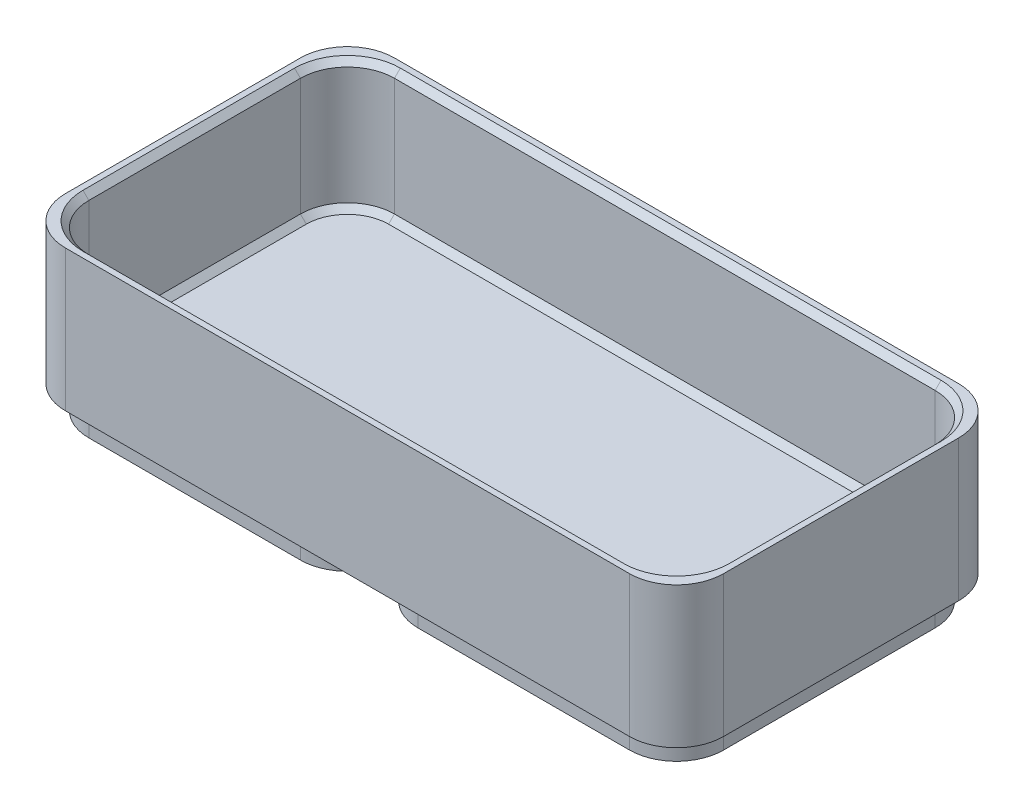
from build123d import *

# Parameters (mm, degrees)
BOSS_EXTRUDE4_DEPTH = 5
SKETCH6_W           = 70
SKETCH6_H           = 70
BOSS_EXTRUDE5_DEPTH = 30
SKETCH8_R           = 3
CUT_EXTRUDE1_DEPTH  = 2
CUT_EXTRUDE2_START  = -30
CUT_EXTRUDE2_DEPTH  = 30
SKETCH10_W          = 140
SKETCH10_H          = 70
BOSS_EXTRUDE6_DEPTH = 2.5
FILLET1_R           = 10
CHAMFER1_SIZE       = 1.25
CHAMFER2_SIZE       = 1.25


with BuildPart() as part:
    # Sketch5 → Boss-Extrude4 (new body)
    with BuildSketch(Plane(origin=(0, 0, 0), x_dir=(1, 0, 0), z_dir=(0, 1, 0))):
        with BuildLine():
            Line((-22.5, -32.5), (22.5, -32.5))
            ThreePointArc((22.5, -32.5), (29.571067812, -29.571067812), (32.5, -22.5))
            Line((32.5, -22.5), (32.5, 22.5))
            ThreePointArc((32.5, 22.5), (29.571067812, 29.571067812), (22.5, 32.5))
            Line((22.5, 32.5), (-22.5, 32.5))
            ThreePointArc((-22.5, 32.5), (-29.571067812, 29.571067812), (-32.5, 22.5))
            Line((-32.5, 22.5), (-32.5, -22.5))
            ThreePointArc((-32.5, -22.5), (-29.571067812, -29.571067812), (-22.5, -32.5))
        make_face()
    extrude(amount=BOSS_EXTRUDE4_DEPTH)

    # Sketch6 → Boss-Extrude5 (add)
    with BuildSketch(Plane(origin=(0, 5, 0), x_dir=(1, 0, 0), z_dir=(0, 1, 0))):
        Rectangle(SKETCH6_W, SKETCH6_H)
    extrude(amount=BOSS_EXTRUDE5_DEPTH)

    # Sketch8 → Cut-Extrude1 (cut)
    with BuildSketch(Plane.XZ):
        with Locations(Location((26.037533906, -26.035533906, 0), (0, 0, 270))):
            Circle(SKETCH8_R)
        with Locations(Location((26.036533906, 26.036533906, 0), (0, 0, 270))):
            Circle(SKETCH8_R)
        with BuildLine():
            ThreePointArc((-23.035533906, 26.035533906), (-24.887483609, 28.807172503), (-28.156854249, 28.156854249))
            Line((-28.156854249, 28.156854249), (-23.914213562, 23.914213562))
            ThreePointArc((-23.914213562, 23.914213562), (-23.263895308, 24.887483609), (-23.035533906, 26.035533906))
        make_face()
        with BuildLine():
            Line((-23.914213562, 23.914213562), (-28.156854249, 28.156854249))
            ThreePointArc((-28.156854249, 28.156854249), (-28.156854249, 23.914213562), (-23.914213562, 23.914213562))
        make_face()
        with Locations(Location((-26.034533906, -26.036533906, 0), (0, 0, 270))):
            Circle(SKETCH8_R)
    extrude(amount=-CUT_EXTRUDE1_DEPTH, mode=Mode.SUBTRACT)

    # Mirror1: part across plane


with BuildPart() as part_1:
    add(part.part)
    add(part.part.mirror(Plane(origin=(-35, 35, -35), x_dir=(0, 0, 1), z_dir=(1, 0, 0))))

    # Sketch9 → Cut-Extrude2 (cut)
    with BuildSketch(Plane(origin=(0, 35, 0), x_dir=(1, 0, 0), z_dir=(0, 1, 0)).offset(CUT_EXTRUDE2_START)):
        with BuildLine():
            Line((22.5, 32.5), (-92.5, 32.5))
            ThreePointArc((-92.5, 32.5), (-99.571067812, 29.571067812), (-102.5, 22.5))
            Line((-102.5, 22.5), (-102.5, -22.5))
            ThreePointArc((-102.5, -22.5), (-99.571067812, -29.571067812), (-92.5, -32.5))
            Line((-92.5, -32.5), (22.5, -32.5))
            ThreePointArc((22.5, -32.5), (29.571067812, -29.571067812), (32.5, -22.5))
            Line((32.5, -22.5), (32.5, 22.5))
            ThreePointArc((32.5, 22.5), (29.571067812, 29.571067812), (22.5, 32.5))
        make_face()
    extrude(amount=CUT_EXTRUDE2_DEPTH, mode=Mode.SUBTRACT)


with BuildPart() as cut_extrude2_piece_1:
    # of the separate pieces the step leaves, piece 1, a body of its own (cut_extrude2_pieces)
    add(part_1.part.solids().sort_by_distance((35, 5, -35))[0])



with BuildPart() as cut_extrude2_piece_2:
    # of the separate pieces the step leaves, piece 2, a body of its own (cut_extrude2_pieces)
    add(part_1.part.solids().sort_by_distance((-22.5, 0, 32.5))[0])


with BuildPart() as cut_extrude2_piece_3:
    # of the separate pieces the step leaves, piece 3, a body of its own (cut_extrude2_pieces)
    add(part_1.part.solids().sort_by_distance((-92.5, 0, -32.5))[0])


with BuildPart() as cut_extrude2_piece_1_1:
    add(cut_extrude2_piece_1.part)

    add(cut_extrude2_piece_2.part)  # Boss-Extrude6 merges Cut-Extrude2 piece 2

    add(cut_extrude2_piece_3.part)  # Boss-Extrude6 merges Cut-Extrude2 piece 3
    # Sketch10 → Boss-Extrude6 (add)
    with BuildSketch(Plane.XZ.offset(-5)):
        with Locations((-35, 0)):
            Rectangle(SKETCH10_W, SKETCH10_H)
    extrude(amount=-BOSS_EXTRUDE6_DEPTH)

    # Fillet1
    fillet1_edges = [cut_extrude2_piece_1_1.edges().sort_by_distance(p)[0] for p in [
        (35, 20, 35),
        (35, 20, -35),
        (-105, 20, 35),
        (-105, 20, -35),
    ]]
    fillet(fillet1_edges, radius=FILLET1_R)

    # Chamfer1
    chamfer1_edges = [cut_extrude2_piece_1_1.edges().sort_by_distance(p)[0] for p in [
        (29.571067812, 7.5, -29.571067812),
        (-35, 7.5, -32.5),
        (-99.571067812, 7.5, -29.571067812),
        (-102.5, 7.5, 0),
        (-99.571067812, 7.5, 29.571067812),
        (-35, 7.5, 32.5),
        (29.571067812, 7.5, 29.571067812),
        (32.5, 7.5, 0),
    ]]
    chamfer(chamfer1_edges, length=CHAMFER1_SIZE)

    # Chamfer2
    chamfer2_edges = [cut_extrude2_piece_1_1.edges().sort_by_distance(p)[0] for p in [
        (-99.571067812, 35, 29.571067812),
        (-35, 35, 32.5),
        (29.571067812, 35, 29.571067812),
        (32.5, 35, 0),
        (29.571067812, 35, -29.571067812),
        (-35, 35, -32.5),
        (-99.571067812, 35, -29.571067812),
        (-102.5, 35, 0),
    ]]
    chamfer(chamfer2_edges, length=CHAMFER2_SIZE)


solid = cut_extrude2_piece_1_1.part
